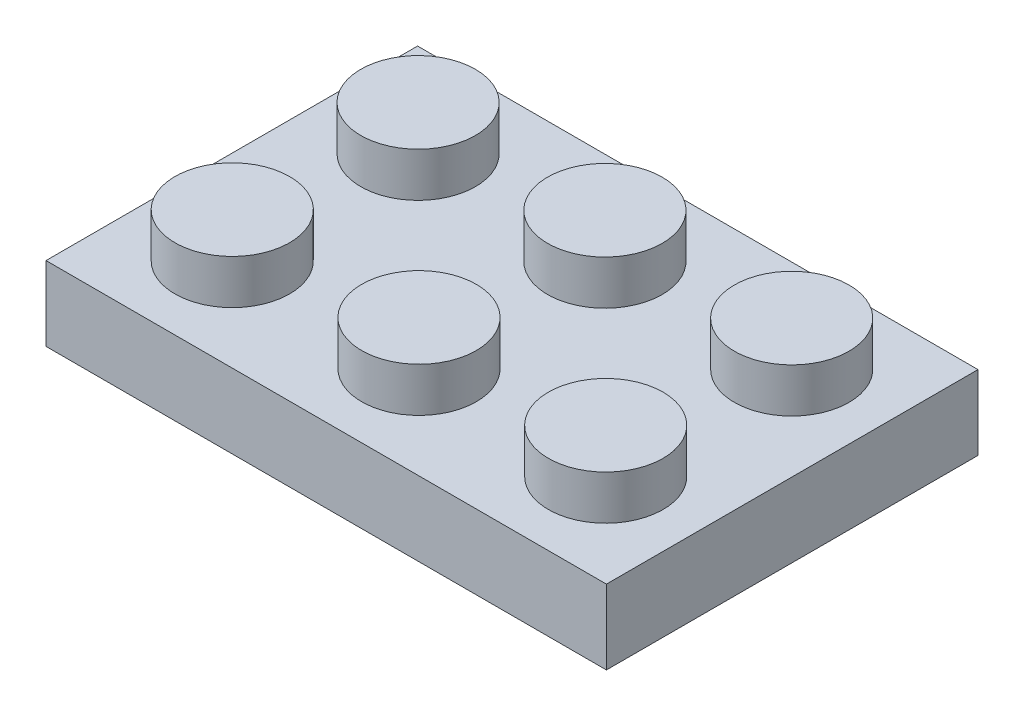
from build123d import *

# Parameters (mm, degrees)
SKETCH1_W           = 23.89
SKETCH1_H           = 15.84
BOSS_EXTRUDE1_DEPTH = 3.17
SKETCH2_R           = 2.445
BOSS_EXTRUDE2_DEPTH = 1.89
SHELL1_T            = -0.8
SKETCH3_R           = 2.975
SKETCH3_R_2         = 2.83
BOSS_EXTRUDE3_DEPTH = 1.47


with BuildPart() as part:
    # Sketch1 → Boss-Extrude1 (new body)
    with BuildSketch(Plane(origin=(0, 0, 0), x_dir=(1, 0, 0), z_dir=(0, 1, 0))):
        Rectangle(SKETCH1_W, SKETCH1_H)
    extrude(amount=-BOSS_EXTRUDE1_DEPTH)

    # Sketch2 → Boss-Extrude2 (add)
    with BuildSketch(Plane(origin=(0, 0, 0), x_dir=(1, 0, 0), z_dir=(0, 1, 0))):
        with Locations(Location((-7.963333333, 3.96, 0), (0, 0, 90))):
            Circle(SKETCH2_R)
        with Locations(Location((0, 3.96, 0), (0, 0, 90))):
            Circle(SKETCH2_R)
        with Locations(Location((7.963333333, 3.96, 0), (0, 0, 90))):
            Circle(SKETCH2_R)
        with Locations(Location((-7.965, -3.96, 0), (0, 0, 90))):
            Circle(SKETCH2_R)
        with Locations(Location((-0.005, -3.96, 0), (0, 0, 90))):
            Circle(SKETCH2_R)
        with Locations(Location((7.955, -3.96, 0), (0, 0, 90))):
            Circle(SKETCH2_R)
    extrude(amount=BOSS_EXTRUDE2_DEPTH)

    # Shell1
    shell1_openings = [part.faces().sort_by_distance(p)[0] for p in [
        (0, -3.17, 0),
    ]]
    offset(amount=SHELL1_T, openings=shell1_openings, kind=Kind.INTERSECTION)

    # Sketch3 → Boss-Extrude3 (add)
    # profile 1 of 2: a face of its own
    with BuildSketch(Plane.XZ.offset(0.8)):
        with Locations(Location((3.981666667, 0, 0), (0, 0, 90))):
            Circle(SKETCH3_R)
        with Locations(Location((3.981666667, 0, 0), (0, 0, 270))):
            Circle(SKETCH3_R_2, mode=Mode.SUBTRACT)
    # profile 2 of 2: a face of its own
    with BuildSketch(Plane.XZ.offset(0.8)):
        with Locations(Location((-3.981666667, 0, 0), (0, 0, 90))):
            Circle(SKETCH3_R)
        with Locations(Location((-3.981666667, 0, 0), (0, 0, 270))):
            Circle(SKETCH3_R_2, mode=Mode.SUBTRACT)
    extrude(amount=BOSS_EXTRUDE3_DEPTH)


solid = part.part
